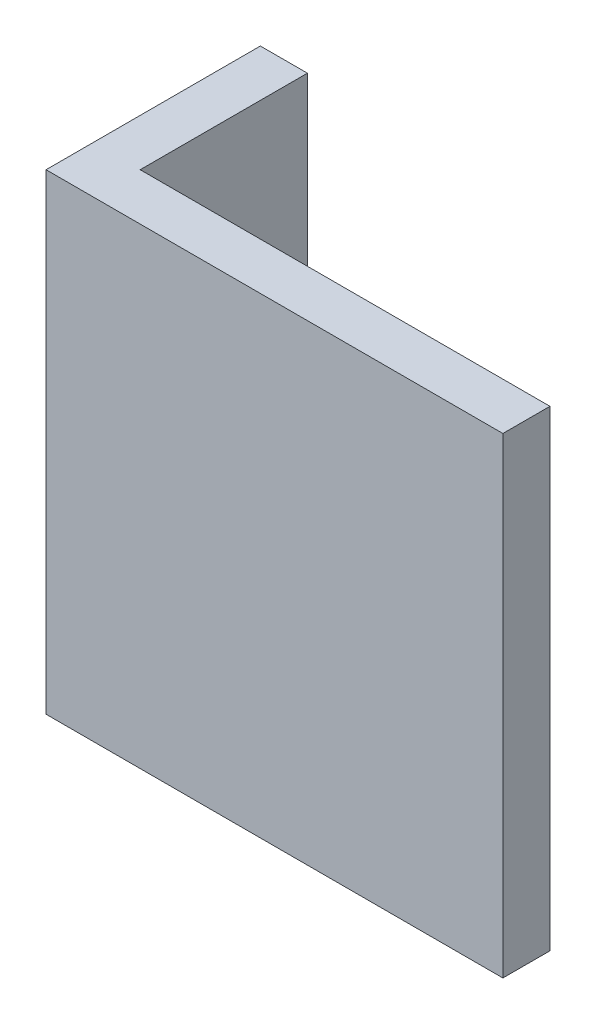
from build123d import *

# Parameters (mm, degrees)
BOSS_EXTRUDE1_DEPTH = 30.06


with BuildPart() as part:
    # Sketch1 → Boss-Extrude1 (new body)
    with BuildSketch(Plane(origin=(0, 0, 0), x_dir=(1, 0, 0), z_dir=(0, 1, 0))):
        Polygon((-2.755107279, -8.58850832), (-2.755107279, -22.24850832), (26.364892721, -22.24850832), (26.364892721, -19.24850832), (0.244892721, -19.24850832), (0.244892721, -8.58850832), align=None)
    extrude(amount=BOSS_EXTRUDE1_DEPTH)


solid = part.part
